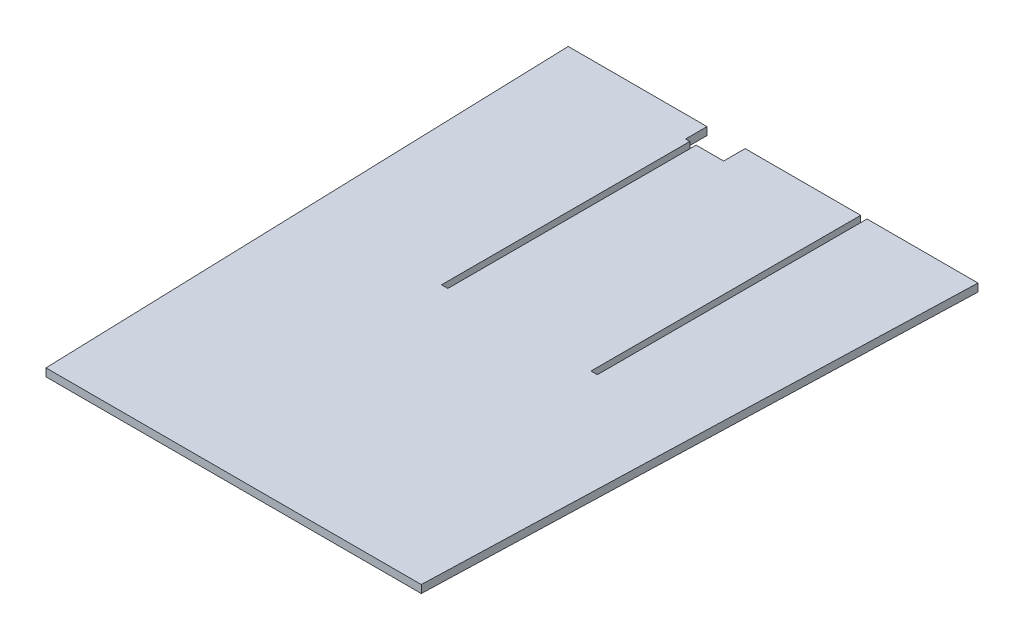
from build123d import *

# Parameters (mm, degrees)
BOSS_EXTRUDE1_DEPTH = 6.35


with BuildPart() as part:
    # Sketch1 → Boss-Extrude1 (new body)
    with BuildSketch(Plane(origin=(0, 0, 0), x_dir=(1, 0, 0), z_dir=(0, 1, 0))):
        Polygon((198.579924435, 458.637839184), (311.330524435, 458.637839184), (311.330524435, 441.175339184), (314.783336935, 441.175339184), (314.783336935, 239.562839184), (319.942711935, 239.562839184), (319.942711935, 441.175339184), (342.280424435, 441.175339184), (342.280424435, 458.637839184), (436.146124435, 458.637839184), (436.146124435, 239.562839184), (441.305499435, 239.562839184), (441.305499435, 458.637839184), (531.401145365, 458.637839184), (517.3905349, 20.487839184), (212.5905349, 20.487839184), align=None)
    extrude(amount=BOSS_EXTRUDE1_DEPTH)


solid = part.part
